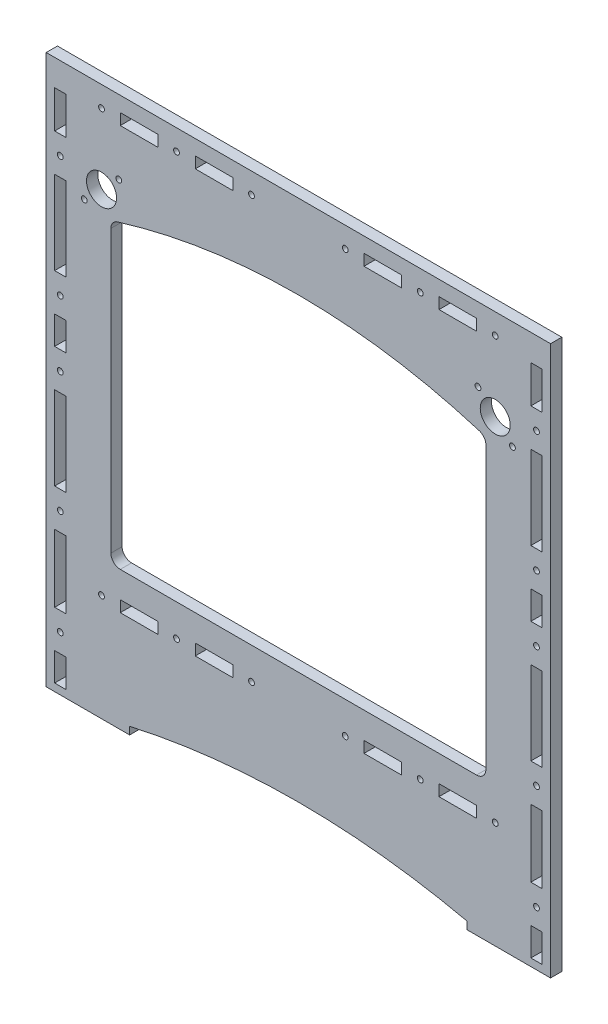
from build123d import *

# Parameters (mm, degrees)
SKETCH1_W           = 260
SKETCH1_H           = 270
BOSS_EXTRUDE1_DEPTH = 6
SKETCH2_W           = 20
SKETCH2_H           = 6
CUT_EXTRUDE1_DEPTH  = 6
CUT_EXTRUDE2_DEPTH  = 10
SKETCH4_W           = 6
SKETCH4_H           = 44.5
SKETCH4_H_2         = 15
SKETCH4_H_3         = 36
CUT_EXTRUDE3_DEPTH  = 6
SKETCH5_R           = 8
CUT_EXTRUDE4_DEPTH  = 10
SKETCH6_R           = 1.55
CUT_EXTRUDE5_DEPTH  = 6
CUT_EXTRUDE7_DEPTH  = 10
SKETCH8_W           = 248
SKETCH8_H           = 6
BOSS_EXTRUDE2_DEPTH = 5
BOSS_EXTRUDE3_DEPTH = 6
SKETCH10_W          = 6
SKETCH10_H          = 5
CUT_EXTRUDE8_DEPTH  = 6
SKETCH11_R          = 1.55
CUT_EXTRUDE9_DEPTH  = 6
SKETCH12_R          = 1.55
CUT_EXTRUDE10_DEPTH = 10
SKETCH13_W          = 269
SKETCH13_H          = 6
BOSS_EXTRUDE4_DEPTH = 14
SKETCH14_W          = 34
SKETCH14_H          = 6
SKETCH14_W_2        = 10.5
SKETCH14_W_3        = 44.5
BOSS_EXTRUDE5_DEPTH = 4
SKETCH15_R          = 1.55
SKETCH15_W          = 20
SKETCH15_H          = 6
CUT_EXTRUDE11_DEPTH = 10


with BuildPart() as part:
    # Sketch1 → Boss-Extrude1 (new body)
    with BuildSketch(Plane.XY):
        with Locations((130, 135)):
            Rectangle(SKETCH1_W, SKETCH1_H)
    extrude(amount=BOSS_EXTRUDE1_DEPTH)

    # Sketch2 → Cut-Extrude1 (cut)
    with BuildSketch(Plane(origin=(0, 0, 0), x_dir=(-1, 0, 0), z_dir=(0, 0, -1))):
        with Locations((-215, 53)):
            Rectangle(SKETCH2_W, SKETCH2_H)
        with Locations((-175, 53)):
            Rectangle(SKETCH2_W, SKETCH2_H)
        with BuildLine():
            Line((-220, 0), (-40, 0))
            ThreePointArc((-40, 0), (-130, 10), (-220, 0))
        make_face()
        with Locations((-85, 53)):
            Rectangle(SKETCH2_W, SKETCH2_H)
        with Locations((-45, 53)):
            Rectangle(SKETCH2_W, SKETCH2_H)
    extrude(amount=-CUT_EXTRUDE1_DEPTH, mode=Mode.SUBTRACT)

    # Sketch3 → Cut-Extrude2 (cut)
    with BuildSketch(Plane(origin=(0, 0, 0), x_dir=(-1, 0, 0), z_dir=(0, 0, -1))):
        with BuildLine():
            Line((-225, 70), (-35, 70))
            ThreePointArc((-35, 70), (-31.464466094, 71.464466094), (-30, 75))
            Line((-30, 75), (-30, 220))
            ThreePointArc((-30, 220), (-31.464466094, 223.535533906), (-35, 225))
            Line((-35, 225), (-225, 225))
            ThreePointArc((-225, 225), (-228.535533906, 223.535533906), (-230, 220))
            Line((-230, 220), (-230, 75))
            ThreePointArc((-230, 75), (-228.535533906, 71.464466094), (-225, 70))
        make_face()
    extrude(amount=-CUT_EXTRUDE2_DEPTH, mode=Mode.SUBTRACT)

    # Sketch4 → Cut-Extrude3 (cut)
    with BuildSketch(Plane(origin=(0, 0, 0), x_dir=(-1, 0, 0), z_dir=(0, 0, -1))):
        Polygon((-254, 270), (-260, 270), (-260, 264), (-260, 255), (-254, 255), (-254, 264), align=None)
        with Locations((-257, 212.75)):
            Rectangle(SKETCH4_W, SKETCH4_H)
        with Locations((-257, 163)):
            Rectangle(SKETCH4_W, SKETCH4_H_2)
        with Locations((-257, 113.25)):
            Rectangle(SKETCH4_W, SKETCH4_H)
        with Locations((-257, 53)):
            Rectangle(SKETCH4_W, SKETCH4_H_3)
        with Locations((-257, 7.5)):
            Rectangle(SKETCH4_W, SKETCH4_H_2)
        with Locations((-3, 7.5)):
            Rectangle(SKETCH4_W, SKETCH4_H_2)
        with Locations((-3, 53)):
            Rectangle(SKETCH4_W, SKETCH4_H_3)
        with Locations((-3, 113.25)):
            Rectangle(SKETCH4_W, SKETCH4_H)
        with Locations((-3, 212.75)):
            Rectangle(SKETCH4_W, SKETCH4_H)
        with Locations((-3, 262.5)):
            Rectangle(SKETCH4_W, SKETCH4_H_2)
        with Locations((-3, 163)):
            Rectangle(SKETCH4_W, SKETCH4_H_2)
    extrude(amount=-CUT_EXTRUDE3_DEPTH, mode=Mode.SUBTRACT)

    # Sketch5 → Cut-Extrude4 (cut)
    with BuildSketch(Plane(origin=(0, 0, 0), x_dir=(-1, 0, 0), z_dir=(0, 0, -1))):
        with Locations((-235, 240.5)):
            Circle(SKETCH5_R)
        with Locations((-25, 240.5)):
            Circle(SKETCH5_R)
    extrude(amount=-CUT_EXTRUDE4_DEPTH, mode=Mode.SUBTRACT)

    # Sketch6 → Cut-Extrude5 (cut)
    with BuildSketch(Plane.XY.offset(6)):
        with Locations((34.20128912, 249.683478563)):
            Circle(SKETCH6_R)
        with Locations((15.816521437, 231.29871088)):
            Circle(SKETCH6_R)
        with Locations(Location((225.79871088, 249.683478563, 0), (0, 0, 180))):
            Circle(SKETCH6_R)
        with Locations(Location((244.183478563, 231.29871088, 0), (0, 0, 180))):
            Circle(SKETCH6_R)
    extrude(amount=-CUT_EXTRUDE5_DEPTH, mode=Mode.SUBTRACT)

    # Sketch7 → Cut-Extrude7 (cut)
    with BuildSketch(Plane.XY.offset(6)):
        with BuildLine():
            Line((30, 225), (30, 202.90481405))
            Line((30, 202.90481405), (230, 202.90481405))
            Line((230, 202.90481405), (230, 225))
            ThreePointArc((230, 225), (229.021842565, 227.970653528), (226.470087046, 229.779000322))
            ThreePointArc((226.470087046, 229.779000322), (130, 244.281446445), (33.529912954, 229.779000322))
            ThreePointArc((33.529912954, 229.779000322), (30.978157435, 227.970653528), (30, 225))
        make_face()
    extrude(amount=-CUT_EXTRUDE7_DEPTH, mode=Mode.SUBTRACT)

    # Sketch8 → Boss-Extrude2 (add)
    with BuildSketch(Plane(origin=(0, 270, 0), x_dir=(1, 0, 0), z_dir=(0, 1, 0))):
        with Locations((130, -3)):
            Rectangle(SKETCH8_W, SKETCH8_H)
    extrude(amount=BOSS_EXTRUDE2_DEPTH)

    # Sketch9 → Boss-Extrude3 (add)
    with BuildSketch(Plane.XY.offset(6)):
        Polygon((0, 270), (0, 0), (-4.5, 0), (-4.5, 275), (6, 275), (6, 270), align=None)
        Polygon((264.5, 275), (264.5, 0), (260, 0), (260, 270), (254, 270), (254, 275), align=None)
    extrude(amount=-BOSS_EXTRUDE3_DEPTH)

    # Sketch10 → Cut-Extrude8 (cut)
    with BuildSketch(Plane.XY.offset(6)):
        with Locations((3, 272.5)):
            Rectangle(SKETCH10_W, SKETCH10_H)
        with Locations((257, 272.5)):
            Rectangle(SKETCH10_W, SKETCH10_H)
    extrude(amount=-CUT_EXTRUDE8_DEPTH, mode=Mode.SUBTRACT)

    # Sketch11 → Cut-Extrude9 (cut)
    with BuildSketch(Plane.XY.offset(6)):
        with Locations((3, 245)):
            Circle(SKETCH11_R)
        with Locations((3, 180.5)):
            Circle(SKETCH11_R)
        with Locations((3, 145.5)):
            Circle(SKETCH11_R)
        with Locations((3, 81)):
            Circle(SKETCH11_R)
        with Locations((3, 25)):
            Circle(SKETCH11_R)
        with Locations(Location((257, 25, 0), (0, 0, 180))):
            Circle(SKETCH11_R)
        with Locations(Location((257, 81, 0), (0, 0, 180))):
            Circle(SKETCH11_R)
        with Locations(Location((257, 145.5, 0), (0, 0, 180))):
            Circle(SKETCH11_R)
        with Locations(Location((257, 180.5, 0), (0, 0, 180))):
            Circle(SKETCH11_R)
        with Locations(Location((257, 245, 0), (0, 0, 180))):
            Circle(SKETCH11_R)
    extrude(amount=-CUT_EXTRUDE9_DEPTH, mode=Mode.SUBTRACT)

    # Sketch12 → Cut-Extrude10 (cut)
    with BuildSketch(Plane.XY.offset(6)):
        with Locations((25, 53)):
            Circle(SKETCH12_R)
        with Locations((65, 53)):
            Circle(SKETCH12_R)
        with Locations((155, 53)):
            Circle(SKETCH12_R)
        with Locations(Location((195, 53, 0), (0, 0, 180))):
            Circle(SKETCH12_R)
        with Locations(Location((235, 53, 0), (0, 0, 180))):
            Circle(SKETCH12_R)
        with Locations((105, 53)):
            Circle(SKETCH12_R)
    extrude(amount=-CUT_EXTRUDE10_DEPTH, mode=Mode.SUBTRACT)

    # Sketch13 → Boss-Extrude4 (add)
    with BuildSketch(Plane(origin=(0, 275, 0), x_dir=(1, 0, 0), z_dir=(0, 1, 0))):
        with Locations((130, -3)):
            Rectangle(SKETCH13_W, SKETCH13_H)
    extrude(amount=BOSS_EXTRUDE4_DEPTH)

    # Sketch14 → Boss-Extrude5 (add)
    with BuildSketch(Plane.XZ):
        with Locations((23, 3)):
            Rectangle(SKETCH14_W, SKETCH14_H)
        with Locations((0.75, 3)):
            Rectangle(SKETCH14_W_2, SKETCH14_H)
        with Locations((242.25, 3)):
            Rectangle(SKETCH14_W_3, SKETCH14_H)
    extrude(amount=BOSS_EXTRUDE5_DEPTH)

    # Sketch15 → Cut-Extrude11 (cut)
    with BuildSketch(Plane.XY.offset(6)):
        with Locations((25, 278)):
            Circle(SKETCH15_R)
        with Locations((105, 278)):
            Circle(SKETCH15_R)
        with Locations((65, 278)):
            Circle(SKETCH15_R)
        with Locations(Location((195, 278, 0), (0, 0, 180))):
            Circle(SKETCH15_R)
        with Locations(Location((155, 278, 0), (0, 0, 180))):
            Circle(SKETCH15_R)
        with Locations(Location((235, 278, 0), (0, 0, 180))):
            Circle(SKETCH15_R)
        with Locations((45, 278)):
            Rectangle(SKETCH15_W, SKETCH15_H)
        with Locations((85, 278)):
            Rectangle(SKETCH15_W, SKETCH15_H)
        with Locations((175, 278)):
            Rectangle(SKETCH15_W, SKETCH15_H)
        with Locations((215, 278)):
            Rectangle(SKETCH15_W, SKETCH15_H)
    extrude(amount=-CUT_EXTRUDE11_DEPTH, mode=Mode.SUBTRACT)


solid = part.part
